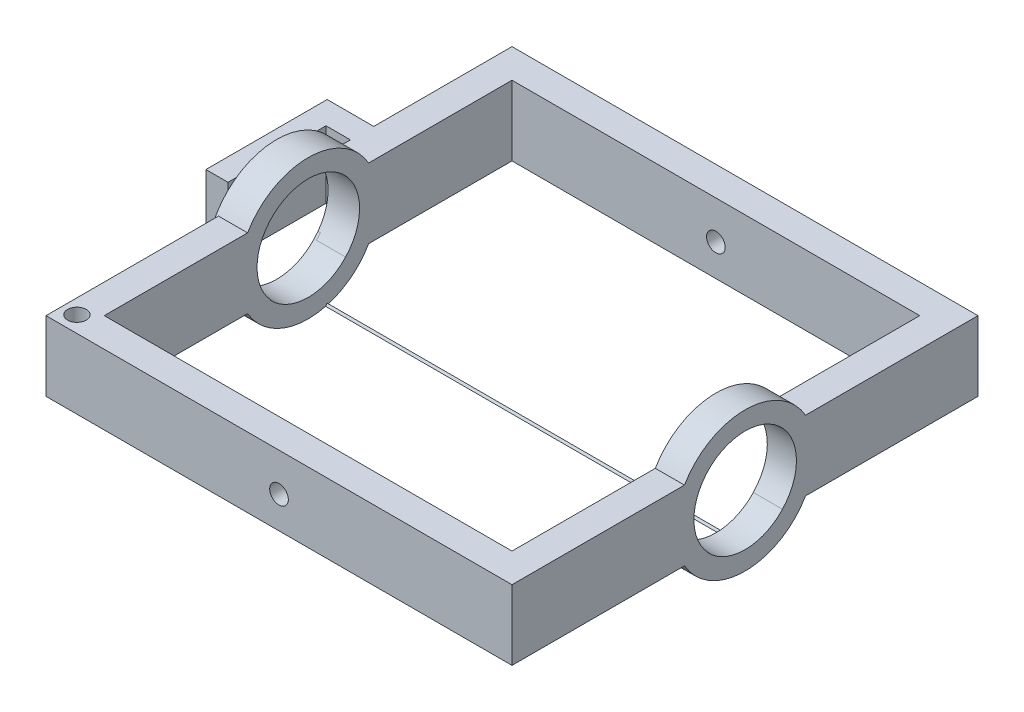
from build123d import *

# Parameters (mm, degrees)
SKETCH1_W           = 200
SKETCH1_H           = 200
BOSS_EXTRUDE1_DEPTH = 30
SKETCH4_W           = 175
SKETCH4_H           = 175
CUT_EXTRUDE1_DEPTH  = 30
SKETCH7_R           = 4
CUT_EXTRUDE2_DEPTH  = 210
SKETCH10_W          = 6.040230253
SKETCH10_H          = 30
BOSS_EXTRUDE2_DEPTH = 20
SKETCH11_W          = 10
SKETCH11_H          = 30
BOSS_EXTRUDE3_DEPTH = 20
CUT_EXTRUDE3_START  = -231
SKETCH12_R          = 4
CUT_EXTRUDE3_DEPTH  = 231
SKETCH13_R          = 4
CUT_EXTRUDE5_DEPTH  = 231
SKETCH14_R          = 4
CUT_EXTRUDE6_DEPTH  = 250.5
SKETCH15_R          = 30
SKETCH15_R_2        = 22
BOSS_EXTRUDE5_DEPTH = 201
SKETCH17_R          = 22
CUT_EXTRUDE7_DEPTH  = 201
SKETCH21_W          = 9.5
SKETCH21_H          = 28.855904386
BOSS_EXTRUDE6_DEPTH = 26
SKETCH22_W          = 9.5
SKETCH22_H          = 6.040230253
CUT_EXTRUDE10_DEPTH = 49
SKETCH23_W          = 10.008922512
SKETCH23_H          = 28.855904386
BOSS_EXTRUDE7_DEPTH = 21
SKETCH24_W          = 9.5
SKETCH24_H          = 1.144095614
CUT_EXTRUDE11_DEPTH = 27
SKETCH26_W          = 0.50137975
SKETCH26_H          = 20.893624798
CUT_EXTRUDE12_DEPTH = 35
SKETCH27_R          = 49.192783102
CUT_EXTRUDE13_DEPTH = 175
SKETCH28_R          = 41.209023923
CUT_EXTRUDE14_DEPTH = 175


with BuildPart() as part:
    # Sketch1 → Boss-Extrude1 (new body)
    with BuildSketch(Plane(origin=(0, 0, 0), x_dir=(1, 0, 0), z_dir=(0, 1, 0))):
        Rectangle(SKETCH1_W, SKETCH1_H)
    extrude(amount=BOSS_EXTRUDE1_DEPTH)

    # Sketch4 → Cut-Extrude1 (cut)
    with BuildSketch(Plane(origin=(0, 30, 0), x_dir=(1, 0, 0), z_dir=(0, 1, 0))):
        Rectangle(SKETCH4_W, SKETCH4_H)
    extrude(amount=-CUT_EXTRUDE1_DEPTH, mode=Mode.SUBTRACT)

    # Sketch7 → Cut-Extrude2 (cut)
    with BuildSketch(Plane.ZY.offset(100)):
        with Locations((0, 15)):
            Circle(SKETCH7_R)
    extrude(amount=-CUT_EXTRUDE2_DEPTH, mode=Mode.SUBTRACT)

    # Sketch10 → Boss-Extrude2 (add)
    with BuildSketch(Plane.ZY.offset(100)):
        with Locations((-11.64671233, 15)):
            Rectangle(SKETCH10_W, SKETCH10_H)
    extrude(amount=BOSS_EXTRUDE2_DEPTH)

    # Sketch11 → Boss-Extrude3 (add)
    with BuildSketch(Plane.XY.offset(-8.626597203)):
        with Locations((-115, 15)):
            Rectangle(SKETCH11_W, SKETCH11_H)
    extrude(amount=BOSS_EXTRUDE3_DEPTH)

    # Sketch12 → Cut-Extrude3 (cut)
    with BuildSketch(Plane(origin=(100, 0, 0), x_dir=(0, 0, -1), z_dir=(1, 0, 0)).offset(CUT_EXTRUDE3_START)):
        with Locations(Location((0, 15, 0), (0, 0, 180))):
            Circle(SKETCH12_R)
    extrude(amount=CUT_EXTRUDE3_DEPTH, mode=Mode.SUBTRACT)

    # Sketch13 → Cut-Extrude5 (cut)
    with BuildSketch(Plane(origin=(0, 30, 0), x_dir=(1, 0, 0), z_dir=(0, 1, 0))):
        with Locations(Location((-93.69452155, -93.045501349, 0), (0, 0, 270))):
            Circle(SKETCH13_R)
    extrude(amount=-CUT_EXTRUDE5_DEPTH, mode=Mode.SUBTRACT)

    # Sketch14 → Cut-Extrude6 (cut)
    with BuildSketch(Plane.XY.offset(100)):
        with Locations((0, 13.614739596)):
            Circle(SKETCH14_R)
    extrude(amount=-CUT_EXTRUDE6_DEPTH, mode=Mode.SUBTRACT)

    # Sketch15 → Boss-Extrude5 (add)
    with BuildSketch(Plane(origin=(100, 0, 0), x_dir=(0, 0, -1), z_dir=(1, 0, 0))):
        with Locations((0, 15)):
            Circle(SKETCH15_R)
        with Locations((0, 15)):
            Circle(SKETCH15_R_2, mode=Mode.SUBTRACT)
    extrude(amount=-BOSS_EXTRUDE5_DEPTH)

    # Sketch17 → Cut-Extrude7 (cut)
    with BuildSketch(Plane(origin=(100, 0, 0), x_dir=(0, 0, -1), z_dir=(1, 0, 0))):
        with Locations((0.074377339, 15.100772812)):
            Circle(SKETCH17_R)
    extrude(amount=-CUT_EXTRUDE7_DEPTH, mode=Mode.SUBTRACT)


with BuildPart() as cut_extrude7_piece_1:
    # of the separate pieces the step leaves, piece 1, a body of its own (cut_extrude7_pieces)
    add(part.part.solids().sort_by_distance((-100, 0, -100))[0])



with BuildPart() as cut_extrude7_piece_2:
    # of the separate pieces the step leaves, piece 2, a body of its own (cut_extrude7_pieces)
    add(part.part.solids().sort_by_distance((-101, 0, -14.666827456))[0])

    # Sketch21 → Boss-Extrude6 (add)
    with BuildSketch(Plane(origin=(0, 0, -14.666827456), x_dir=(-1, 0, 0), z_dir=(0, 0, -1))):
        with Locations((115.25, 15.572047807)):
            Rectangle(SKETCH21_W, SKETCH21_H)
    extrude(amount=BOSS_EXTRUDE6_DEPTH)

    # Sketch22 → Cut-Extrude10 (cut)
    with BuildSketch(Plane(origin=(0, 30, 0), x_dir=(1, 0, 0), z_dir=(0, 1, 0))):
        with Locations((-105.75, 11.64671233)):
            Rectangle(SKETCH22_W, SKETCH22_H)
    extrude(amount=-CUT_EXTRUDE10_DEPTH, mode=Mode.SUBTRACT)


with BuildPart() as cut_extrude7_piece_1_1:
    add(cut_extrude7_piece_1.part)

    add(cut_extrude7_piece_2.part)  # Boss-Extrude7 merges Cut-Extrude7 piece 2
    # Sketch23 → Boss-Extrude7 (add)
    with BuildSketch(Plane(origin=(-110.5, 0, 0), x_dir=(0, 0, -1), z_dir=(1, 0, 0))):
        with Locations((35.6623662, 15.572047807)):
            Rectangle(SKETCH23_W, SKETCH23_H)
    extrude(amount=BOSS_EXTRUDE7_DEPTH)

    # Sketch24 → Cut-Extrude11 (cut)
    with BuildSketch(Plane(origin=(0, 0, -14.666827456), x_dir=(-1, 0, 0), z_dir=(0, 0, -1))):
        with Locations((115.25, 0.572047807)):
            Rectangle(SKETCH24_W, SKETCH24_H)
    extrude(amount=-CUT_EXTRUDE11_DEPTH, mode=Mode.SUBTRACT)

    # Sketch26 → Cut-Extrude12 (cut)
    with BuildSketch(Plane.XZ):
        with Locations((-110.249310125, 1.820215196)):
            Rectangle(SKETCH26_W, SKETCH26_H)
    extrude(amount=-CUT_EXTRUDE12_DEPTH, mode=Mode.SUBTRACT)

    # Sketch27 → Cut-Extrude13 (cut)
    with BuildSketch(Plane(origin=(-87.5, 0, 0), x_dir=(0, 0, -1), z_dir=(1, 0, 0))):
        with Locations((-31.916352411, 15.376133278)):
            Circle(SKETCH27_R)
    extrude(amount=CUT_EXTRUDE13_DEPTH, mode=Mode.SUBTRACT)

    # Sketch28 → Cut-Extrude14 (cut)
    with BuildSketch(Plane(origin=(-87.5, 0, 0), x_dir=(0, 0, -1), z_dir=(1, 0, 0))):
        with Locations((37.762434774, 15.494435184)):
            Circle(SKETCH28_R)
    extrude(amount=CUT_EXTRUDE14_DEPTH, mode=Mode.SUBTRACT)


solid = cut_extrude7_piece_1_1.part
